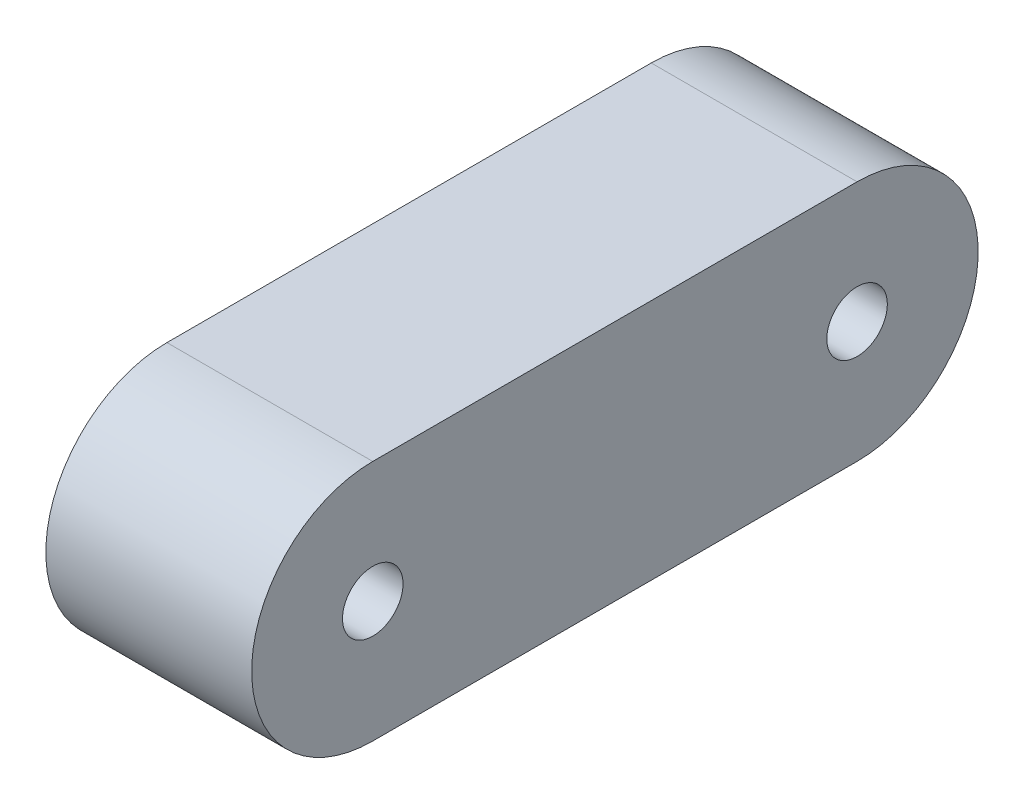
from build123d import *

# Parameters (mm, degrees)
CROQUIS1_R              = 2.5
SALIENTE_EXTRUIR1_DEPTH = 8.5


with BuildPart() as part:
    # Croquis1 → Saliente-Extruir1 (new, symmetric)
    with BuildSketch(Plane(origin=(0, 0, 0), x_dir=(0, 0, -1), z_dir=(1, 0, 0))):
        with BuildLine():
            Line((-20, 10), (20, 10))
            ThreePointArc((20, 10), (30, 0), (20, -10))
            Line((20, -10), (-20, -10))
            ThreePointArc((-20, -10), (-30, 0), (-20, 10))
        make_face()
        with Locations((-20, 0)):
            Circle(CROQUIS1_R, mode=Mode.SUBTRACT)
        with Locations((20, 0)):
            Circle(CROQUIS1_R, mode=Mode.SUBTRACT)
    extrude(amount=SALIENTE_EXTRUIR1_DEPTH, both=True)


solid = part.part
